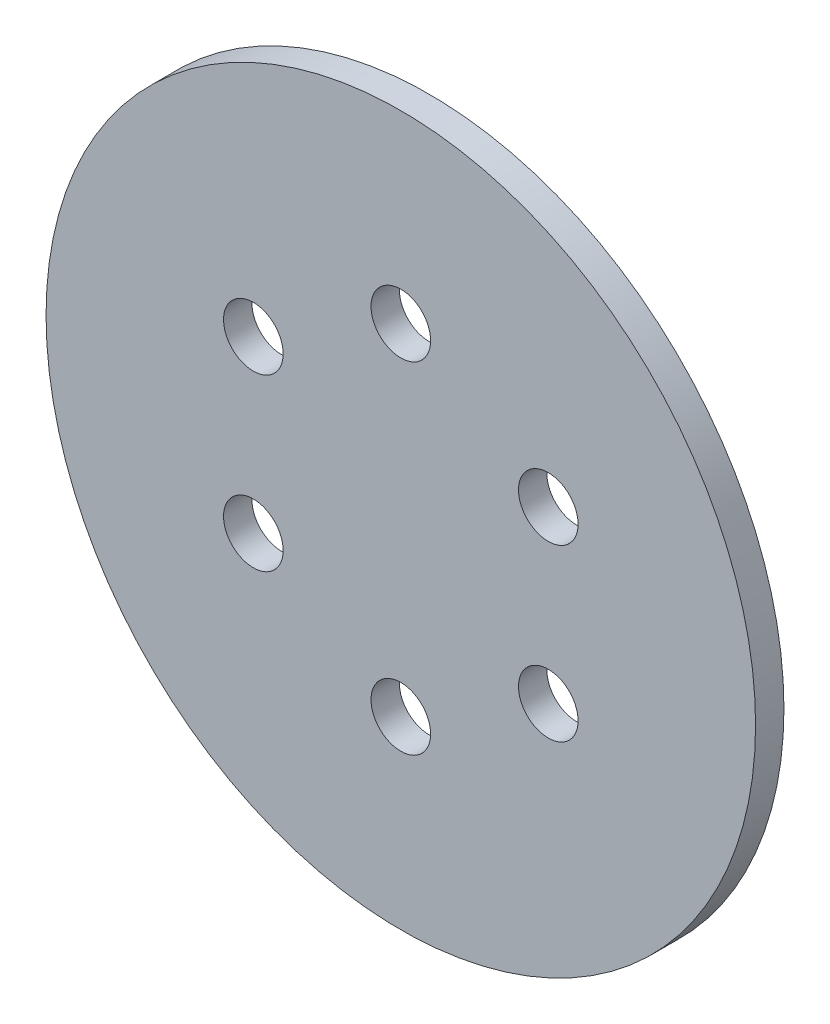
from build123d import *

# Parameters (mm, degrees)
SKETCH_1_R      = 25
SKETCH_1_R_2    = 2.1
EXTRUDE_1_DEPTH = 2


with BuildPart() as part:
    # 草图1 → 凸台-拉伸1 (new body)
    with BuildSketch(Plane.XY):
        Circle(SKETCH_1_R)
        with Locations((0, 12)):
            Circle(SKETCH_1_R_2, mode=Mode.SUBTRACT)
        with Locations((10.392304845, 6)):
            Circle(SKETCH_1_R_2, mode=Mode.SUBTRACT)
        with Locations((10.392304845, -6)):
            Circle(SKETCH_1_R_2, mode=Mode.SUBTRACT)
        with Locations((0, -12)):
            Circle(SKETCH_1_R_2, mode=Mode.SUBTRACT)
        with Locations((-10.392304845, -6)):
            Circle(SKETCH_1_R_2, mode=Mode.SUBTRACT)
        with Locations((-10.392304845, 6)):
            Circle(SKETCH_1_R_2, mode=Mode.SUBTRACT)
    extrude(amount=EXTRUDE_1_DEPTH)


solid = part.part
